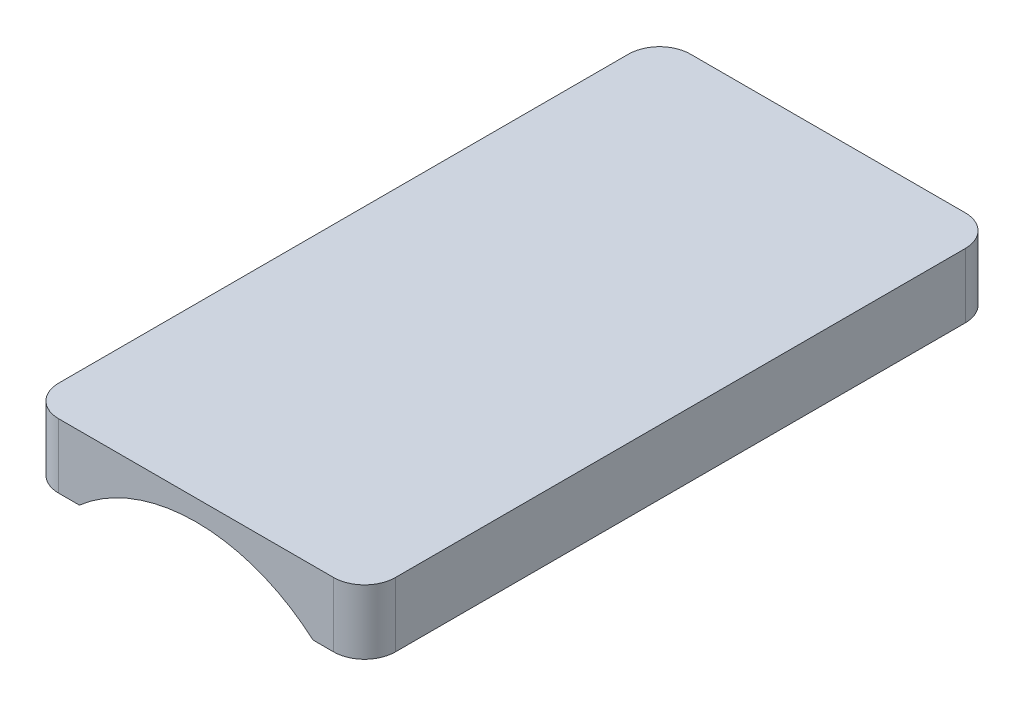
from build123d import *

# Parameters (mm, degrees)
SKETCH1_W               = 61.25
SKETCH1_H               = 6.25
BOSS_EXTRUDE1_DEPTH     = 32.65
CUT_EXTRUDE1_DEPTH      = 70.689651312
CUT_EXTRUDE1_DEPTH_BACK = 35
CUT_EXTRUDE2_DEPTH      = 10
FILLET1_R               = 3


with BuildPart() as part:
    # Sketch1 → Boss-Extrude1 (new body)
    with BuildSketch(Plane(origin=(0, 0, 0), x_dir=(0, 0, -1), z_dir=(1, 0, 0))):
        with Locations((30.625, 3.125)):
            Rectangle(SKETCH1_W, SKETCH1_H)
    extrude(amount=BOSS_EXTRUDE1_DEPTH)

    # Sketch2 → Cut-Extrude1 (cut, two sides: drawn at the far end of the back side and taken through both)
    with BuildSketch(Plane.XY.offset(-CUT_EXTRUDE1_DEPTH_BACK)):
        with BuildLine():
            Line((5, 0), (27.65, 0))
            ThreePointArc((27.65, 0), (16.325, 4.25), (5, 0))
        make_face()
    extrude(amount=CUT_EXTRUDE1_DEPTH + CUT_EXTRUDE1_DEPTH_BACK, mode=Mode.SUBTRACT)

    # Sketch3 → Cut-Extrude2 (cut)
    with BuildSketch(Plane(origin=(0, 0, -61.25), x_dir=(-1, 0, 0), z_dir=(0, 0, -1))):
        Polygon((-11.175, 0.95), (-11.175, 5.3), (-21.475, 5.3), (-19.3, 3.125), (-21.475, 0.95), align=None)
    extrude(amount=-CUT_EXTRUDE2_DEPTH, mode=Mode.SUBTRACT)

    # Fillet1
    fillet1_edges = [part.edges().sort_by_distance(p)[0] for p in [
        (32.65, 3.125, 0),
        (0, 3.125, 0),
        (0, 3.125, -61.25),
        (32.65, 3.125, -61.25),
    ]]
    fillet(fillet1_edges, radius=FILLET1_R)


solid = part.part
